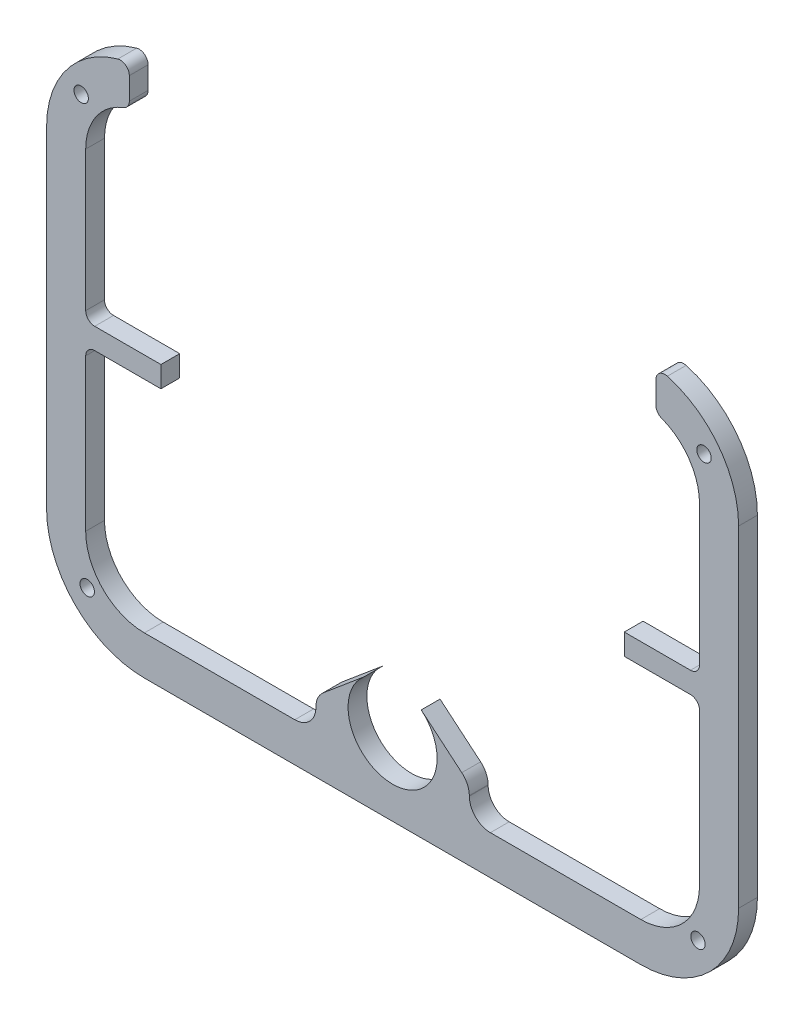
from build123d import *

# Parameters (mm, degrees)
SKETCH1_W           = 6.35
SKETCH1_H           = 1.778
BOSS_EXTRUDE1_DEPTH = 1.5875
CUT_EXTRUDE1_REACH  = 38.738
SKETCH2_W           = 3.155094666
SKETCH2_H           = 2.647438771
FILLET1_R           = 1.778
FILLET2_R           = 0.762
FILLET3_R           = 0.762
SKETCH3_R           = 0.6096
CUT_EXTRUDE2_DEPTH  = 1.5875


with BuildPart() as part:
    # Sketch1 → Boss-Extrude1 (new body)
    # profile 1 of 3: a face of its own
    with BuildSketch(Plane.XY):
        with BuildLine():
            ThreePointArc((29.21, 13.97), (26.792166479, 19.807166479), (20.955, 22.225))
            Line((20.955, 22.225), (-20.955, 22.225))
            ThreePointArc((-20.955, 22.225), (-26.792166479, 19.807166479), (-29.21, 13.97))
            Line((-29.21, 13.97), (-29.21, -13.97))
            ThreePointArc((-29.21, -13.97), (-26.792166479, -19.807166479), (-20.955, -22.225))
            Line((-20.955, -22.225), (20.955, -22.225))
            ThreePointArc((20.955, -22.225), (26.792166479, -19.807166479), (29.21, -13.97))
            Line((29.21, -13.97), (29.21, 13.97))
        make_face()
        with BuildLine():
            Line((-9.632094666, -18.923), (-20.955, -18.923))
            ThreePointArc((-20.955, -18.923), (-24.457299887, -17.472299887), (-25.908, -13.97))
            Line((-25.908, -13.97), (-25.908, -1.27))
            Line((-25.908, -1.27), (-25.908, -0.381))
            Line((-25.908, -0.381), (-25.908, 0))
            Line((-25.908, 0), (-25.908, 1.397))
            Line((-25.908, 1.397), (-25.908, 13.97))
            ThreePointArc((-25.908, 13.97), (-24.457299887, 17.472299887), (-20.955, 18.923))
            Line((-20.955, 18.923), (20.955, 18.923))
            ThreePointArc((20.955, 18.923), (24.457299887, 17.472299887), (25.908, 13.97))
            Line((25.908, 13.97), (25.908, 1.397))
            Line((25.908, 1.397), (25.908, -0.381))
            Line((25.908, -0.381), (25.908, -13.97))
            ThreePointArc((25.908, -13.97), (24.457299887, -17.472299887), (20.955, -18.923))
            Line((20.955, -18.923), (9.632094666, -18.923))
            Line((9.632094666, -18.923), (2.416367182, -12.868285729))
            ThreePointArc((2.416367182, -12.868285729), (0, -19.5072), (-2.416367182, -12.868285729))
            Line((-2.416367182, -12.868285729), (-9.632094666, -18.923))
        make_face(mode=Mode.SUBTRACT)
    # profile 2 of 3: a face of its own
    with BuildSketch(Plane.XY):
        with Locations((22.733, 0.508)):
            Rectangle(SKETCH1_W, SKETCH1_H)
    # profile 3 of 3: a face of its own
    with BuildSketch(Plane.XY):
        Polygon((-25.908, 0), (-25.908, -0.381), (-19.558, -0.381), (-19.558, 1.397), (-25.908, 1.397), align=None)
    extrude(amount=BOSS_EXTRUDE1_DEPTH)

    # Sketch2 → Cut-Extrude1 (cut, up to next)
    with BuildSketch(Plane.XY.offset(1.5875), mode=Mode.PRIVATE) as cut_extrude1_sk1:
        with Locations((-8.054547333, -17.599280615)):
            Rectangle(SKETCH2_W, SKETCH2_H)
    cut_extrude1_tool1 = extrude(cut_extrude1_sk1.sketch, amount=-CUT_EXTRUDE1_REACH, mode=Mode.PRIVATE) & part.part
    # Sketch2 → Cut-Extrude1 (cut, up to next)
    with BuildSketch(Plane.XY.offset(1.5875), mode=Mode.PRIVATE) as cut_extrude1_sk2:
        with Locations((8.054547333, -17.599280615)):
            Rectangle(SKETCH2_W, SKETCH2_H)
    cut_extrude1_tool2 = extrude(cut_extrude1_sk2.sketch, amount=-CUT_EXTRUDE1_REACH, mode=Mode.PRIVATE) & part.part
    # Sketch2 → Cut-Extrude1 (cut, up to next)
    with BuildSketch(Plane.XY.offset(1.5875), mode=Mode.PRIVATE) as cut_extrude1_sk3:
        with BuildLine():
            Line((-20.955, 18.923), (20.955, 18.923))
            ThreePointArc((20.955, 18.923), (21.595374802, 18.881428419), (22.225, 18.757411514))
            Line((22.225, 18.757411514), (22.225, 22.225))
            Line((22.225, 22.225), (-22.225, 22.225))
            Line((-22.225, 22.225), (-22.225, 18.757411514))
            ThreePointArc((-22.225, 18.757411514), (-21.595374802, 18.881428419), (-20.955, 18.923))
        make_face()
    cut_extrude1_tool3 = extrude(cut_extrude1_sk3.sketch, amount=-CUT_EXTRUDE1_REACH, mode=Mode.PRIVATE) & part.part
    add(cut_extrude1_tool1.solids().sort_by_distance((-8.054547, -17.599281, 1.5875))[0], mode=Mode.SUBTRACT)
    add(cut_extrude1_tool2.solids().sort_by_distance((8.054547, -17.599281, 1.5875))[0], mode=Mode.SUBTRACT)
    add(cut_extrude1_tool3.solids().sort_by_distance((0, 20.572388, 1.5875))[0], mode=Mode.SUBTRACT)

    # Fillet1
    fillet1_edges = [part.edges().sort_by_distance(p)[0] for p in [
        (-6.477, -18.923, 0.79375),
        (-6.477, -16.275561229, 0.79375),
        (6.477, -18.923, 0.79375),
        (6.477, -16.275561229, 0.79375),
    ]]
    fillet(fillet1_edges, radius=FILLET1_R)

    # Fillet2
    fillet2_edges = [part.edges().sort_by_distance(p)[0] for p in [
        (-22.225, 22.126722687, 0.79375),
        (-22.225, 18.757411514, 0.79375),
        (22.225, 18.757411514, 0.79375),
        (22.225, 22.126722687, 0.79375),
    ]]
    fillet(fillet2_edges, radius=FILLET2_R)

    # Fillet3
    fillet3_edges = [part.edges().sort_by_distance(p)[0] for p in [
        (25.908, -0.381, 0.79375),
        (25.908, 1.397, 0.79375),
        (-25.908, 1.397, 0.79375),
        (-25.908, -0.381, 0.79375),
    ]]
    fillet(fillet3_edges, radius=FILLET3_R)

    # Sketch3 → Cut-Extrude2 (cut)
    with BuildSketch(Plane.XY.offset(1.5875)):
        with Locations((-26.289, 17.78)):
            Circle(SKETCH3_R)
        with Locations((-25.781, -18.034)):
            Circle(SKETCH3_R)
        with Locations((26.289, 17.78)):
            Circle(SKETCH3_R)
        with Locations((25.781, -18.034)):
            Circle(SKETCH3_R)
    extrude(amount=-CUT_EXTRUDE2_DEPTH, mode=Mode.SUBTRACT)


solid = part.part
